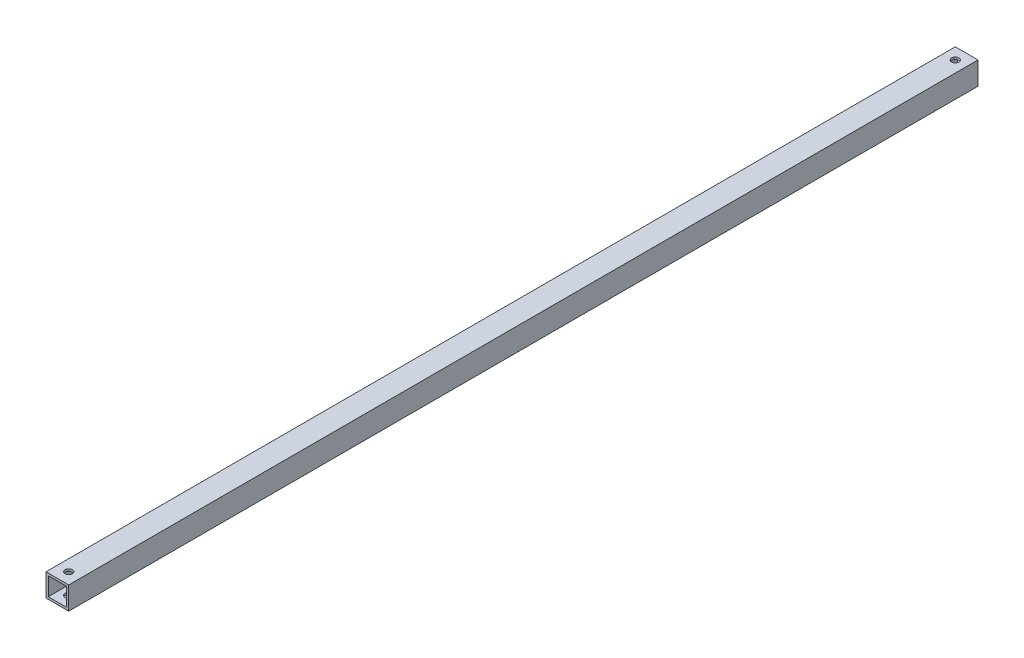
from build123d import *

# Parameters (mm, degrees)
SKETCH_1_W          = 10
SKETCH_1_H          = 10
SKETCH_1_W_2        = 8
SKETCH_1_H_2        = 8
EXTRUDE_1_DEPTH     = 399.7114317
SKETCH_2_R          = 1.6
CUT_EXTRUDE_1_DEPTH = 408.37168574


with BuildPart() as part:
    # ｽｹｯﾁ1 → ﾎﾞｽ - 押し出し1 (new body)
    with BuildSketch(Plane.XY):
        Rectangle(SKETCH_1_W, SKETCH_1_H)
        Rectangle(SKETCH_1_W_2, SKETCH_1_H_2, mode=Mode.SUBTRACT)
    extrude(amount=EXTRUDE_1_DEPTH)

    # ｽｹｯﾁ2 → ｶｯﾄ - 押し出し1 (cut)
    with BuildSketch(Plane(origin=(0, 5, 0), x_dir=(1, 0, 0), z_dir=(0, 1, 0))):
        with Locations(Location((0, -5, 0), (0, 0, 270))):
            Circle(SKETCH_2_R)
        with Locations(Location((0, -394.7114317, 0), (0, 0, 270))):
            Circle(SKETCH_2_R)
    extrude(amount=-CUT_EXTRUDE_1_DEPTH, mode=Mode.SUBTRACT)


solid = part.part
